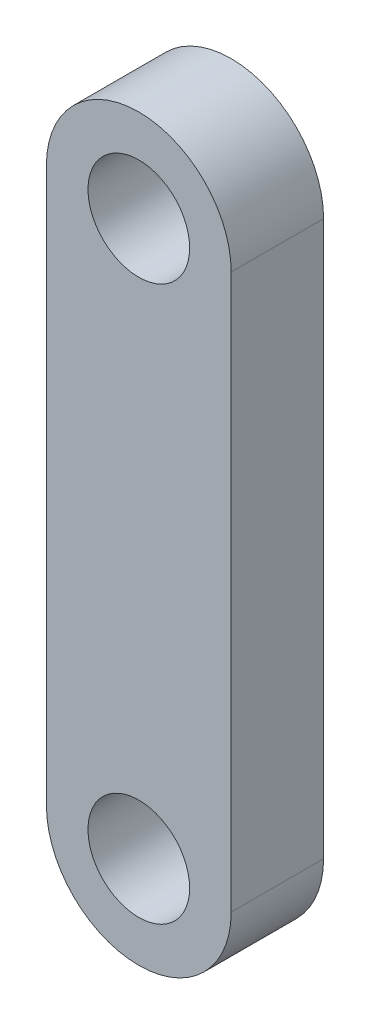
from build123d import *

# Parameters (mm, degrees)
SKETCH1_R           = 1.397
BOSS_EXTRUDE1_DEPTH = 2.54


with BuildPart() as part:
    # Sketch1 → Boss-Extrude1 (new body)
    with BuildSketch(Plane.XY):
        with BuildLine():
            Line((2.54, -7.62), (2.54, 7.62))
            ThreePointArc((2.54, 7.62), (0, 10.16), (-2.54, 7.62))
            Line((-2.54, 7.62), (-2.54, -7.62))
            ThreePointArc((-2.54, -7.62), (0, -10.16), (2.54, -7.62))
        make_face()
        with Locations((0, -7.62)):
            Circle(SKETCH1_R, mode=Mode.SUBTRACT)
        with Locations((0, 7.62)):
            Circle(SKETCH1_R, mode=Mode.SUBTRACT)
    extrude(amount=BOSS_EXTRUDE1_DEPTH)


solid = part.part
